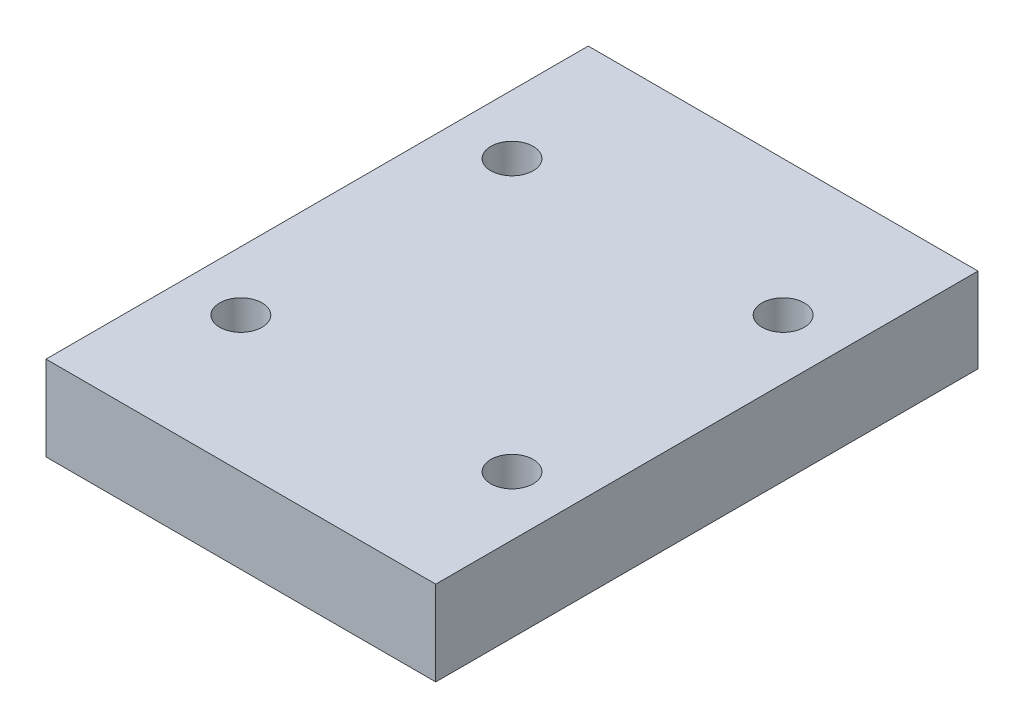
from build123d import *

# Parameters (mm, degrees)
SKETCH_1_W      = 23
SKETCH_1_H      = 32
SKETCH_1_R      = 1.25
EXTRUDE_1_DEPTH = 5


with BuildPart() as part:
    # 草图1 → 凸台-拉伸1 (new body)
    with BuildSketch(Plane(origin=(0, 0, 0), x_dir=(1, 0, 0), z_dir=(0, 1, 0))):
        Rectangle(SKETCH_1_W, SKETCH_1_H)
        with Locations(Location((-8, -8, 0), (0, 0, 270))):
            Circle(SKETCH_1_R, mode=Mode.SUBTRACT)
        with Locations(Location((-8, 8, 0), (0, 0, 90))):
            Circle(SKETCH_1_R, mode=Mode.SUBTRACT)
        with Locations(Location((8, 8, 0), (0, 0, 270))):
            Circle(SKETCH_1_R, mode=Mode.SUBTRACT)
        with Locations(Location((8, -8, 0), (0, 0, 90))):
            Circle(SKETCH_1_R, mode=Mode.SUBTRACT)
    extrude(amount=EXTRUDE_1_DEPTH)


solid = part.part
